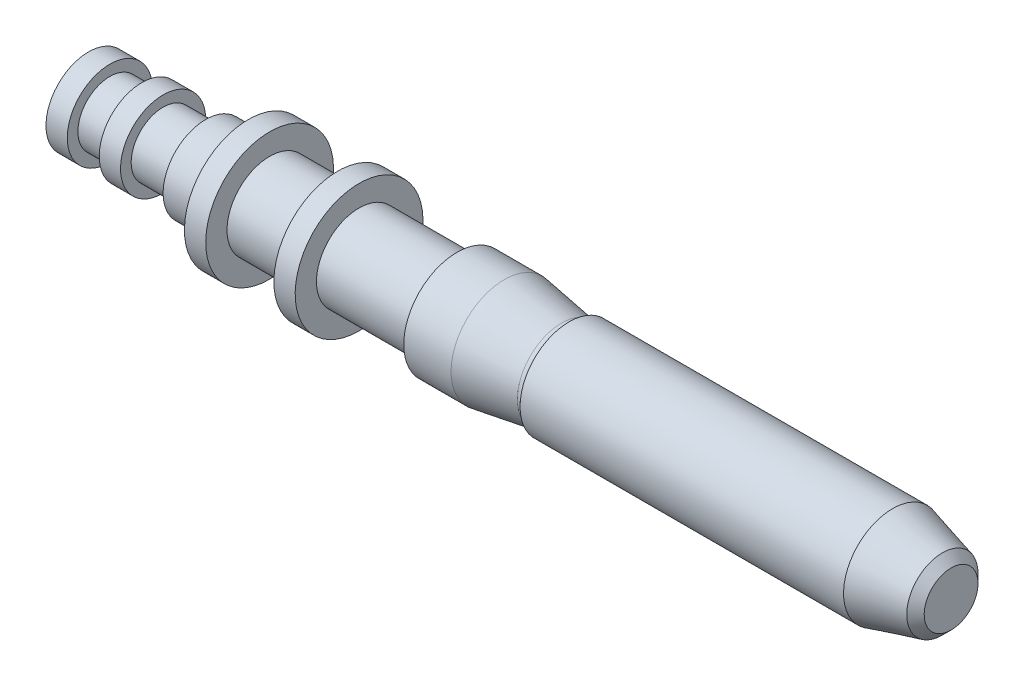
from build123d import *

# Parameters (mm, degrees)
FILLET1_R      = 0.0762
CHAMFER1_SIZE  = 0.0762
CHAMFER1_SIZE2 = 0.107763073


with BuildPart() as part:
    # Sketch1 → Revolve1 (revolve)
    with BuildSketch(Plane.XY, mode=Mode.PRIVATE) as revolve1_sk:
        Polygon((6.955835037, 0.508), (6.955835037, 0), (17.242835037, 0), (17.242835037, 0.397037489), (16.544335037, 0.5842), (12.686075037, 0.5842), (12.648252987, 0.518690288), (11.913915037, 0.635), (11.350035037, 0.635), (11.350035037, 0.508), (10.181635037, 0.508), (10.181635037, 0.762), (9.927635037, 0.762), (9.927635037, 0.508), (9.114835037, 0.508), (9.114835037, 0.762), (8.860835037, 0.762), (8.860835037, 0.508), (8.352835037, 0.508), (8.352835037, 0.381), (7.844835037, 0.381), (7.844835037, 0.508), (7.590835037, 0.508), (7.590835037, 0.381), (7.209835037, 0.381), (7.209835037, 0.508), align=None)
    revolve(revolve1_sk.sketch.rotate(Axis((-986.284560053, 0, 0), (1, 0, 0)), 180), axis=Axis((-986.284560053, 0, 0), (1, 0, 0)))

    # Fillet1
    fillet1_edges = [part.edges().sort_by_distance(p)[0] for p in [
        (12.648252987, 0.518690288, 0),
    ]]
    fillet(fillet1_edges, radius=FILLET1_R)

    # Chamfer1
    chamfer1_edges = [part.edges().sort_by_distance(p)[0] for p in [
        (17.242835037, 0.397037489, 0),
    ]]
    chamfer1_side = [part.faces().sort_by_distance(p)[0] for p in [
        (17.242835037, 0, 0),
    ]]
    chamfer(chamfer1_edges, length=CHAMFER1_SIZE, length2=CHAMFER1_SIZE2, reference=chamfer1_side[0])


solid = part.part
